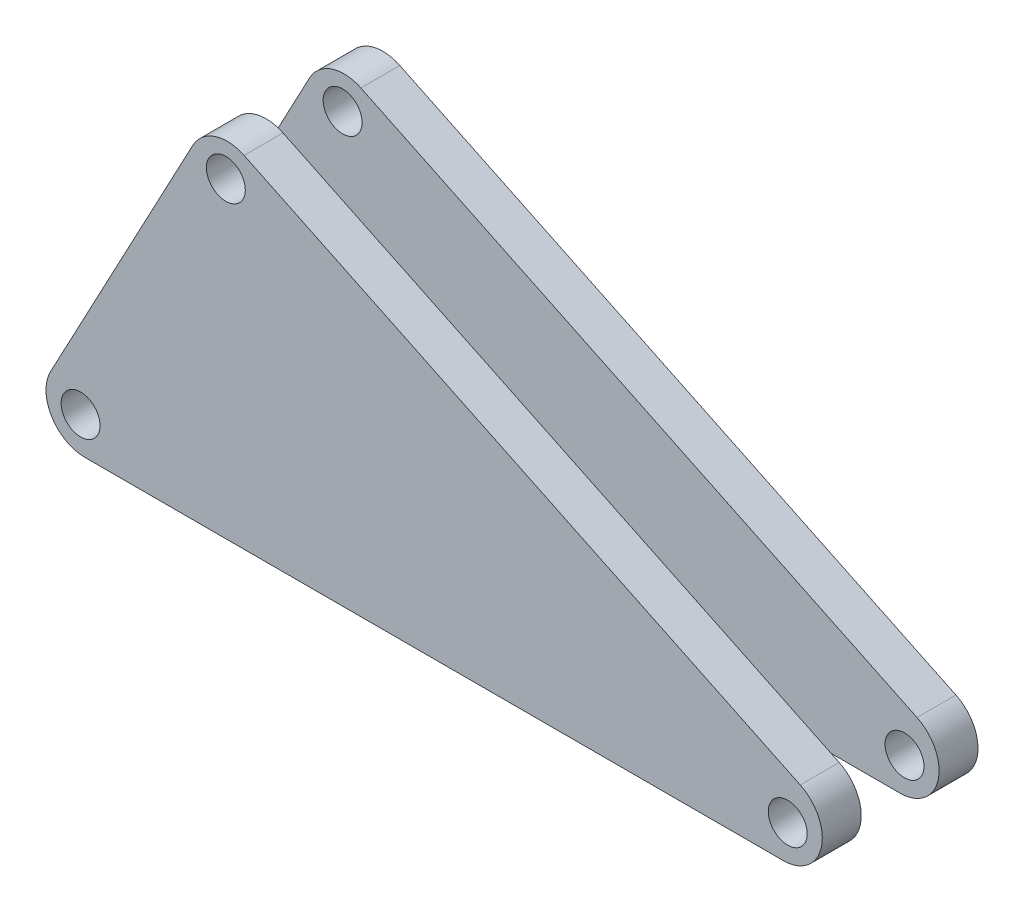
from build123d import *

# Parameters (mm, degrees)
BOSS_EXTRUDE1_DEPTH = 40
FILLET1_R           = 10
SKETCH2_R           = 5
CUT_EXTRUDE1_DEPTH  = 187.36326547
SKETCH3_W           = 439.206836257
SKETCH3_H           = 20
CUT_EXTRUDE2_DEPTH  = 187.36326547


with BuildPart() as part:
    # Sketch1 → Boss-Extrude1 (new body)
    with BuildSketch(Plane.XY):
        Polygon((0, 0), (-48.9, -91.786654803), (191.1, -91.786654803), align=None)
    extrude(amount=BOSS_EXTRUDE1_DEPTH)

    # Fillet1
    fillet1_edges = [part.edges().sort_by_distance(p)[0] for p in [
        (191.1, -91.786654803, 20),
        (-48.9, -91.786654803, 20),
        (0, 0, 20),
    ]]
    fillet(fillet1_edges, radius=FILLET1_R)

    # Sketch2 → Cut-Extrude1 (cut, through all)
    with BuildSketch(Plane.XY.offset(40)):
        with Locations((3.959113896, -11.709737823)):
            Circle(SKETCH2_R)
        with Locations((-33.359838925, -82.786654803)):
            Circle(SKETCH2_R)
        with Locations((148.300974274, -82.786654803)):
            Circle(SKETCH2_R)
    extrude(amount=-CUT_EXTRUDE1_DEPTH, mode=Mode.SUBTRACT)

    # Sketch3 → Cut-Extrude2 (cut, through all)
    with BuildSketch(Plane(origin=(0, 0, 0), x_dir=(1, 0, 0), z_dir=(0, 1, 0))):
        with Locations((151.512499475, -20)):
            Rectangle(SKETCH3_W, SKETCH3_H)
    extrude(amount=-CUT_EXTRUDE2_DEPTH, mode=Mode.SUBTRACT)


with BuildPart() as cut_extrude2_piece_1:
    # of the separate pieces the step leaves, piece 1, a body of its own (cut_extrude2_pieces)
    add(part.part.solids().sort_by_distance((-4.509652982, -8.46474359, 0))[0])


with BuildPart() as cut_extrude2_piece_2:
    # of the separate pieces the step leaves, piece 2, a body of its own (cut_extrude2_pieces)
    add(part.part.solids().sort_by_distance((-41.067444821, -77.084731726, 30))[0])


solid = Compound([cut_extrude2_piece_1.part, cut_extrude2_piece_2.part])
